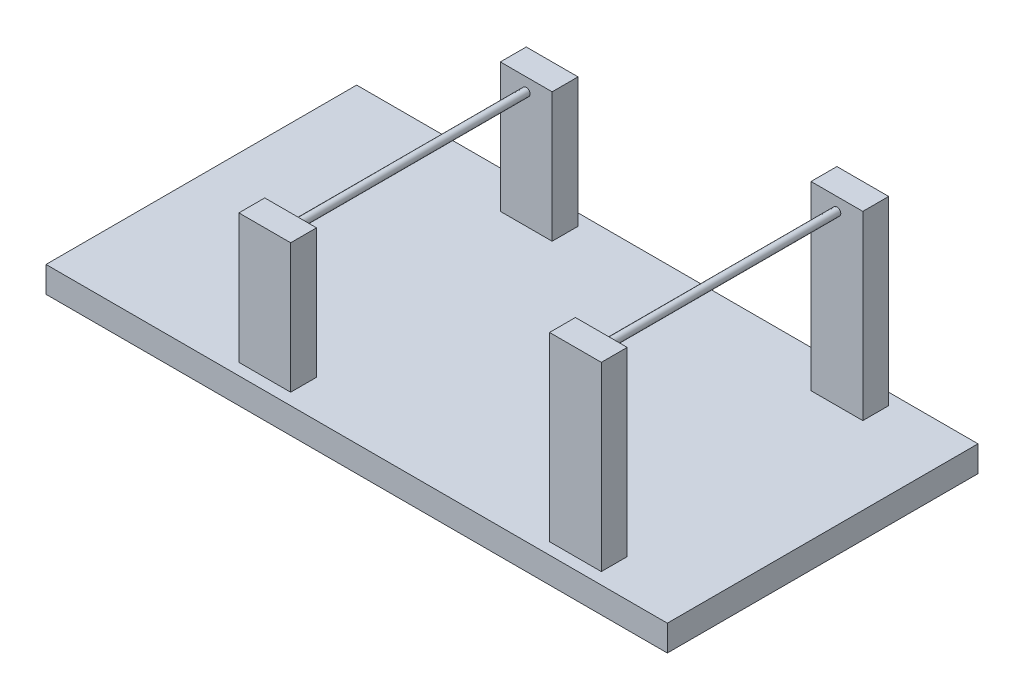
from build123d import *

# Parameters (mm, degrees)
CROQUIS1_W              = 240
CROQUIS1_H              = 120
SALIENTE_EXTRUIR1_DEPTH = 10
CROQUIS2_W              = 20
CROQUIS2_H              = 10
SALIENTE_EXTRUIR2_DEPTH = 50
CROQUIS2_3_W            = 20
CROQUIS2_3_H            = 10
SALIENTE_EXTRUIR3_DEPTH = 70
CROQUIS3_R              = 1.5
SALIENTE_EXTRUIR4_DEPTH = 111


with BuildPart() as part:
    # Croquis1 → Saliente-Extruir1 (new body)
    with BuildSketch(Plane(origin=(0, 0, 0), x_dir=(1, 0, 0), z_dir=(0, 1, 0))):
        Rectangle(CROQUIS1_W, CROQUIS1_H)
    extrude(amount=SALIENTE_EXTRUIR1_DEPTH)

    # Croquis2 → Saliente-Extruir2 (add)
    with BuildSketch(Plane(origin=(0, 10, 0), x_dir=(1, 0, 0), z_dir=(0, 1, 0))):
        with Locations((-40, 50.5)):
            Rectangle(CROQUIS2_W, CROQUIS2_H)
        with Locations((-40, -50.5)):
            Rectangle(CROQUIS2_W, CROQUIS2_H)
    extrude(amount=SALIENTE_EXTRUIR2_DEPTH)

    # Croquis2<3> → Saliente-Extruir3 (add)
    with BuildSketch(Plane(origin=(0, 10, 0), x_dir=(1, 0, 0), z_dir=(0, 1, 0))):
        with Locations((80, 50.5)):
            Rectangle(CROQUIS2_3_W, CROQUIS2_3_H)
        with Locations((80, -50.5)):
            Rectangle(CROQUIS2_3_W, CROQUIS2_3_H)
    extrude(amount=SALIENTE_EXTRUIR3_DEPTH)

    # Croquis3 → Saliente-Extruir4 (add)
    with BuildSketch(Plane.XY.offset(55.5)):
        with Locations((-40, 55)):
            Circle(CROQUIS3_R)
        with Locations((80, 75)):
            Circle(CROQUIS3_R)
    extrude(amount=-SALIENTE_EXTRUIR4_DEPTH)


solid = part.part
